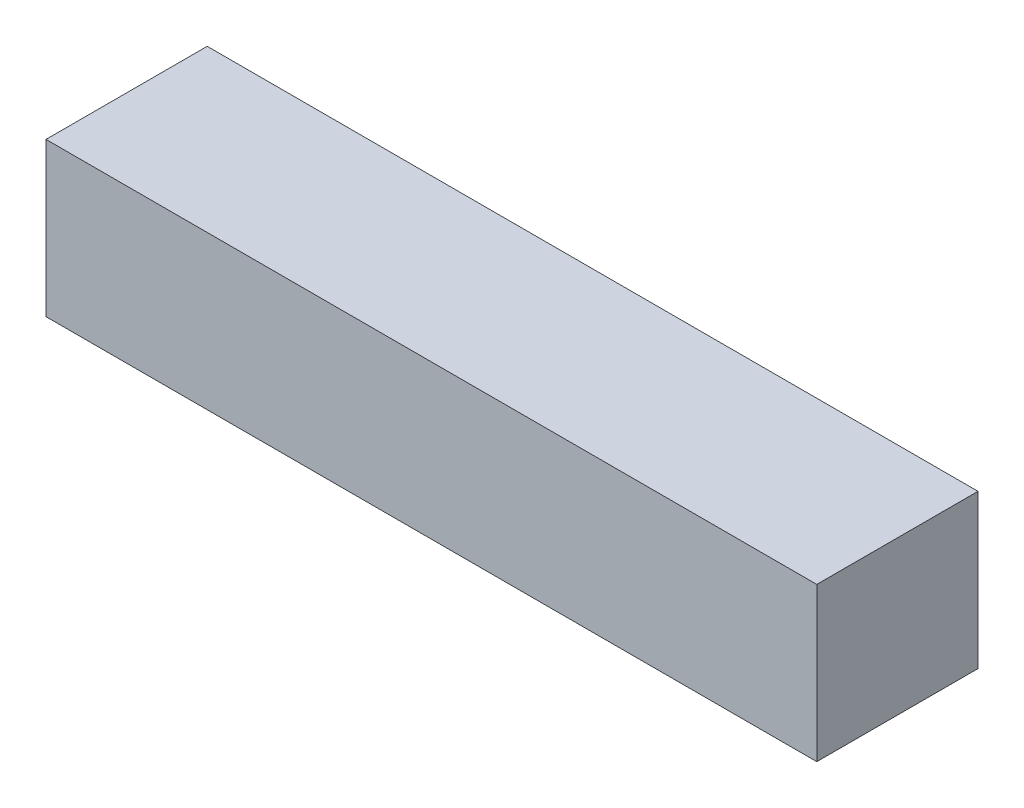
from build123d import *

# Parameters (mm, degrees)
SKETCH1_W           = 20.08
SKETCH1_H           = 4.2
BOSS_EXTRUDE1_DEPTH = 4


with BuildPart() as part:
    # Sketch1 → Boss-Extrude1 (new body)
    with BuildSketch(Plane(origin=(0, 0, 0), x_dir=(1, 0, 0), z_dir=(0, 1, 0))):
        Rectangle(SKETCH1_W, SKETCH1_H)
    extrude(amount=BOSS_EXTRUDE1_DEPTH)


solid = part.part
